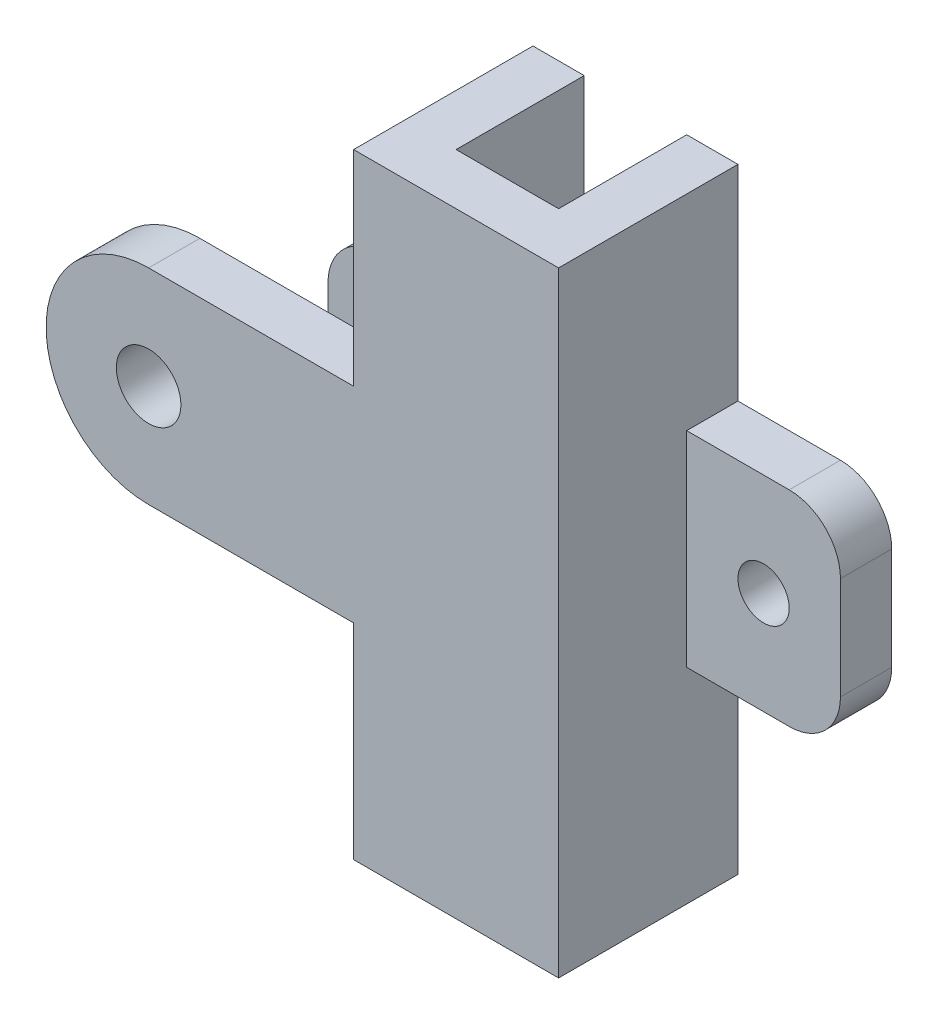
from build123d import *

# Parameters (mm, degrees)
BOSS_EXTRUDE1_DEPTH = 76.2
SKETCH3_R           = 4.0005
BOSS_EXTRUDE2_DEPTH = 6.35
SKETCH4_W           = 19.05
SKETCH4_H           = 25.4
SKETCH4_R           = 3.175
BOSS_EXTRUDE3_DEPTH = 6.35
FILLET1_R           = 6.35


with BuildPart() as part:
    # Sketch2 → Boss-Extrude1 (new body)
    with BuildSketch(Plane(origin=(0, 0, 0), x_dir=(1, 0, 0), z_dir=(0, 1, 0))):
        Polygon((0, 22.225), (0, 0), (25.4, 0), (25.4, 22.225), (19.05, 22.225), (19.05, 6.35), (6.35, 6.35), (6.35, 22.225), align=None)
    extrude(amount=BOSS_EXTRUDE1_DEPTH)

    # Sketch3 → Boss-Extrude2 (add)
    with BuildSketch(Plane.XY):
        with BuildLine():
            Line((12.7, 50.8), (-25.4, 50.8))
            ThreePointArc((-25.4, 50.8), (-38.1, 38.1), (-25.4, 25.4))
            Line((-25.4, 25.4), (12.7, 25.4))
            ThreePointArc((12.7, 25.4), (25.4, 38.1), (12.7, 50.8))
        make_face()
        with Locations((-25.4, 38.1)):
            Circle(SKETCH3_R, mode=Mode.SUBTRACT)
    extrude(amount=-BOSS_EXTRUDE2_DEPTH)

    # Sketch4 → Boss-Extrude3 (add)
    # profile 1 of 2: a face of its own
    with BuildSketch(Plane(origin=(0, 0, -22.225), x_dir=(-1, 0, 0), z_dir=(0, 0, -1))):
        with Locations((-34.925, 38.1)):
            Rectangle(SKETCH4_W, SKETCH4_H)
        with Locations((-34.925, 38.1)):
            Circle(SKETCH4_R, mode=Mode.SUBTRACT)
    # profile 2 of 2: a face of its own
    with BuildSketch(Plane(origin=(0, 0, -22.225), x_dir=(-1, 0, 0), z_dir=(0, 0, -1))):
        with Locations((9.525, 38.1)):
            Rectangle(SKETCH4_W, SKETCH4_H)
        with Locations(Location((9.525, 38.1, 0), (0, 0, 180))):
            Circle(SKETCH4_R, mode=Mode.SUBTRACT)
    extrude(amount=-BOSS_EXTRUDE3_DEPTH)

    # Fillet1
    fillet1_edges = [part.edges().sort_by_distance(p)[0] for p in [
        (44.45, 25.4, -19.05),
        (44.45, 50.8, -19.05),
        (-19.05, 50.8, -19.05),
        (-19.05, 25.4, -19.05),
    ]]
    fillet(fillet1_edges, radius=FILLET1_R)


solid = part.part
